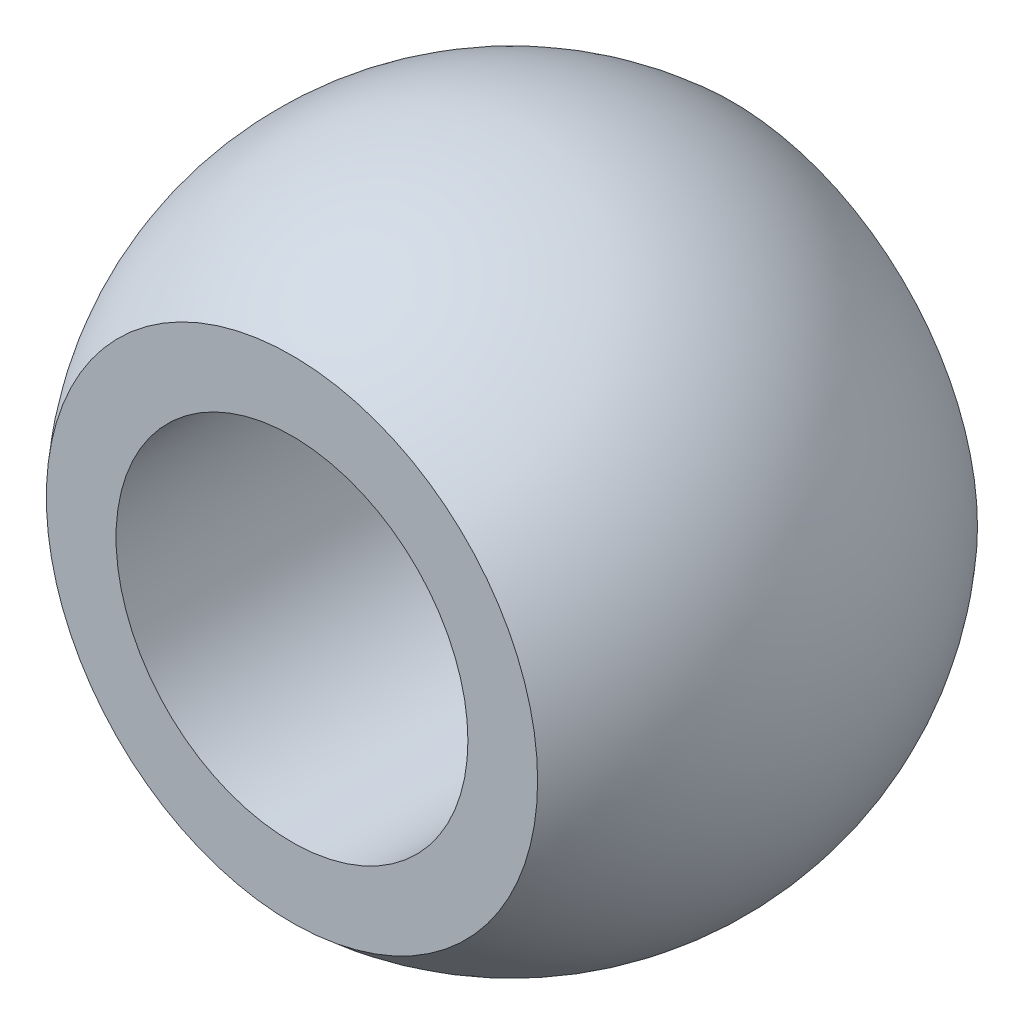
from build123d import *

# Parameters (mm, degrees)
SKETCH2_R      = 6.35
EXTRUDE1_DEPTH = 25.4
EXTRUDE2_REACH = 28.014
SKETCH3_R      = 11.8999


with BuildPart() as part:
    # Sketch1 → Revolve1 (revolve)
    with BuildSketch(Plane.XY):
        with BuildLine():
            Line((0, 11.8999), (0, -11.8999))
            ThreePointArc((0, -11.8999), (11.8999, 0), (0, 11.8999))
        make_face()
    revolve(axis=Axis((0, -11.8999, 0), (0, 1, 0)))

    # Sketch2 → Extrude1 (cut, symmetric)
    with BuildSketch(Plane.XY):
        with Locations(Location((0, 0, 0), (0, 0, 180))):
            Circle(SKETCH2_R)
    extrude(amount=EXTRUDE1_DEPTH, both=True, mode=Mode.SUBTRACT)

    # Sketch3 → Extrude2 (cut, up to next)
    with BuildSketch(Plane.XY.offset(7.9375), mode=Mode.PRIVATE) as extrude2_sk1:
        Circle(SKETCH3_R)
    extrude2_tool1 = extrude(extrude2_sk1.sketch, amount=EXTRUDE2_REACH, mode=Mode.PRIVATE) & part.part
    extrude2 = extrude2_tool1.solids().sort_by_distance((0, 0, 7.9375))[0]
    add(extrude2, mode=Mode.SUBTRACT)

    # Mirror1: Extrude2 across plane
    add(extrude2.mirror(Plane.XY), mode=Mode.SUBTRACT)


solid = part.part
